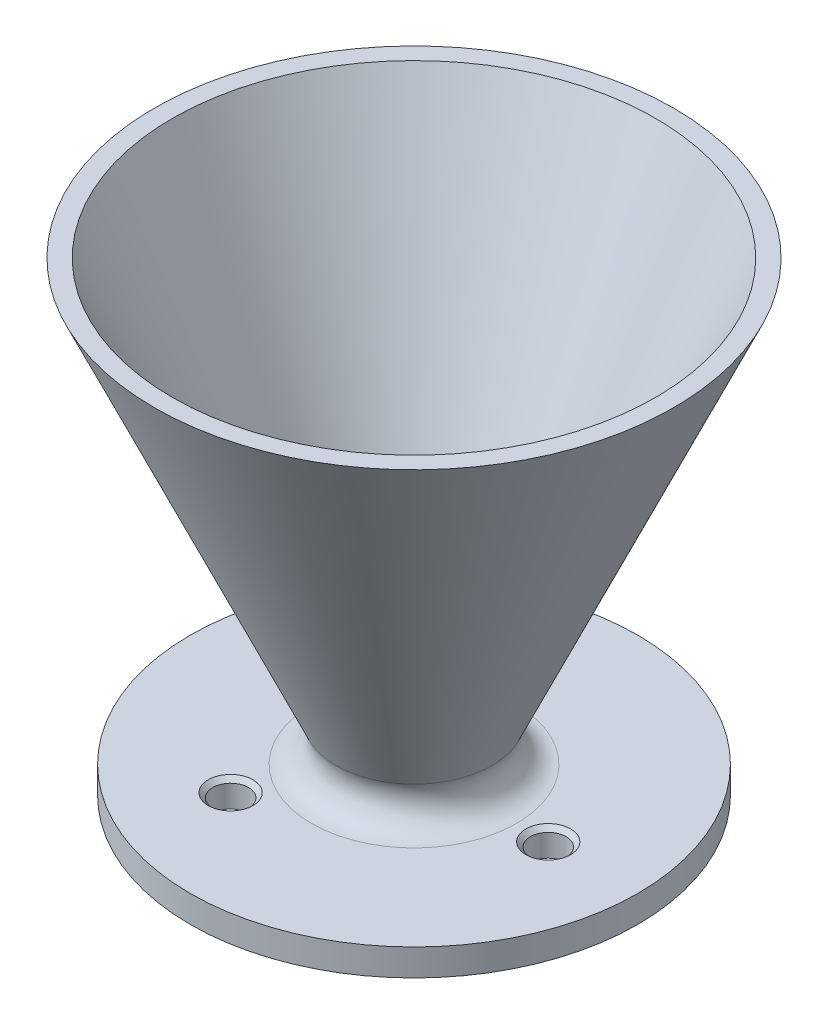
from build123d import *

# Parameters (mm, degrees)
SKETCH1_R                          = 25
SKETCH1_R_2                        = 4.8
BOSS_EXTRUDE1_DEPTH                = 3
F_4_0_4_DIAMETER_HOLE1_D           = 4
F_4_0_4_DIAMETER_HOLE1_CSINK_D     = 5
F_4_0_4_DIAMETER_HOLE1_CSINK_ANGLE = 90
FILLET2_R                          = 3


with BuildPart() as part:
    # Sketch1 → Boss-Extrude1 (new body)
    with BuildSketch(Plane(origin=(0, 0, 0), x_dir=(1, 0, 0), z_dir=(0, 1, 0))):
        with Locations(Location((0, 0, 0), (0, 0, 270))):
            Circle(SKETCH1_R)
        with Locations(Location((0, 0, 0), (0, 0, 270))):
            Circle(SKETCH1_R_2, mode=Mode.SUBTRACT)
    extrude(amount=BOSS_EXTRUDE1_DEPTH)

    # Ø4.0 (4) Diameter Hole1 (through all)
    with Locations(Plane(origin=(0, 3, 0), x_dir=(1, 0, 0), z_dir=(0, 1, 0))):
        with Locations((-7.5, 12.990381057), (15, 0), (-7.5, -12.990381057)):
            CounterSinkHole(F_4_0_4_DIAMETER_HOLE1_D / 2, F_4_0_4_DIAMETER_HOLE1_CSINK_D / 2, counter_sink_angle=F_4_0_4_DIAMETER_HOLE1_CSINK_ANGLE)

    # Sketch8 → Revolve1 (revolve)
    with BuildSketch(Plane.XY, mode=Mode.PRIVATE) as revolve1_sk:
        Polygon((27, 52), (29, 52), (6.8, 3), (4.8, 3), align=None)
    revolve(revolve1_sk.sketch.rotate(Axis((0, 0, 0), (0, 1, 0)), 270), axis=Axis((0, 0, 0), (0, 1, 0)))

    # Fillet2
    fillet2_edges = [part.edges().sort_by_distance(p)[0] for p in [
        (0, 3, -6.8),
    ]]
    fillet(fillet2_edges, radius=FILLET2_R)


solid = part.part
